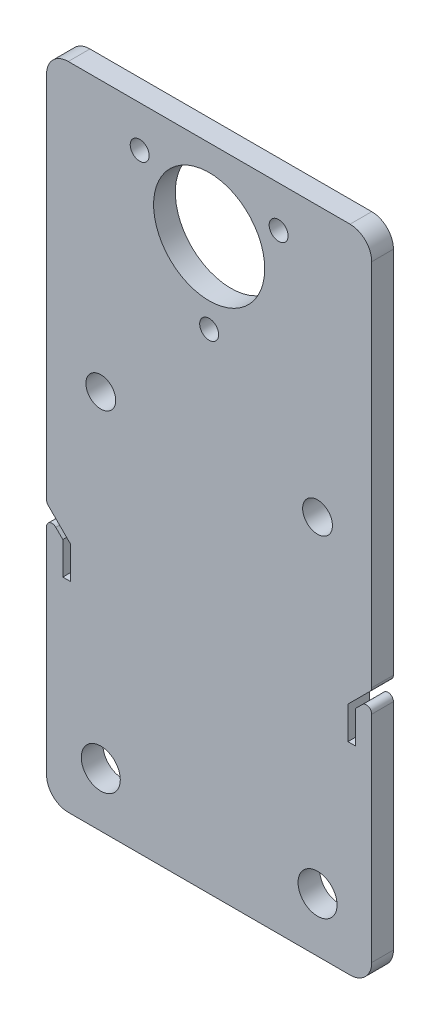
from build123d import *

# Parameters (mm, degrees)
SZKIC1_W                    = 60
SZKIC1_H                    = 120
SZKIC1_R                    = 2.75
SZKIC1_R_2                  = 3.6
SZKIC1_R_3                  = 10.25
SZKIC1_R_4                  = 1.75
DODANIE_WYCI_GNI_CIE1_DEPTH = 4
ZAOKR_GLENIE1_R             = 4
SZKIC2_W                    = 1.4
SZKIC2_H                    = 6
WYTNIJ_WYCI_GNI_CIE1_DEPTH  = 10
ZAOKR_GLENIE2_R             = 1
ZAOKR_GLENIE3_R             = 1


with BuildPart() as part:
    # Szkic1 → Dodanie-wyciągnięcie1 (new body)
    with BuildSketch(Plane.XY):
        with Locations((19.115931961, 35.506335127)):
            Rectangle(SZKIC1_W, SZKIC1_H)
        with Locations((-0.884068039, 45.706335127)):
            Circle(SZKIC1_R, mode=Mode.SUBTRACT)
        with Locations((-0.884068039, -14.493664873)):
            Circle(SZKIC1_R_2, mode=Mode.SUBTRACT)
        with Locations((39.115931961, -14.493664873)):
            Circle(SZKIC1_R_2, mode=Mode.SUBTRACT)
        with Locations((39.115931961, 45.706335127)):
            Circle(SZKIC1_R, mode=Mode.SUBTRACT)
        with Locations((19.115931961, 80.506335127)):
            Circle(SZKIC1_R_3, mode=Mode.SUBTRACT)
        with Locations((6.298755985, 87.906335127)):
            Circle(SZKIC1_R_4, mode=Mode.SUBTRACT)
        with Locations((31.933107937, 87.906335127)):
            Circle(SZKIC1_R_4, mode=Mode.SUBTRACT)
        with Locations((19.115931961, 65.706335127)):
            Circle(SZKIC1_R_4, mode=Mode.SUBTRACT)
    extrude(amount=DODANIE_WYCI_GNI_CIE1_DEPTH)

    # Zaokrąglenie1
    zaokr_glenie1_edges = [part.edges().sort_by_distance(p)[0] for p in [
        (-10.884068039, 95.506335127, 2),
        (49.115931961, 95.506335127, 2),
        (49.115931961, -24.493664873, 2),
        (-10.884068039, -24.493664873, 2),
    ]]
    fillet(zaokr_glenie1_edges, radius=ZAOKR_GLENIE1_R)

    # Szkic2 → Wytnij-wyciągnięcie1 (cut)
    with BuildSketch(Plane.XY.offset(4)):
        with Locations((-7.184068039, 15.606335127)):
            Rectangle(SZKIC2_W, SZKIC2_H)
        Polygon((-10.884068039, 21.606335127), (-7.884068039, 18.606335127), (-6.484068039, 18.606335127), (-10.884068039, 23.006335127), align=None)
        Polygon((49.115931961, 23.006335127), (44.715931961, 18.606335127), (46.115931961, 18.606335127), (49.115931961, 21.606335127), align=None)
        with Locations((45.415931961, 15.606335127)):
            Rectangle(SZKIC2_W, SZKIC2_H)
    extrude(amount=-WYTNIJ_WYCI_GNI_CIE1_DEPTH, mode=Mode.SUBTRACT)

    # Zaokrąglenie2
    zaokr_glenie2_edges = [part.edges().sort_by_distance(p)[0] for p in [
        (49.115931961, 21.606335127, 2),
        (49.115931961, 23.006335127, 2),
    ]]
    fillet(zaokr_glenie2_edges, radius=ZAOKR_GLENIE2_R)

    # Zaokrąglenie3
    zaokr_glenie3_edges = [part.edges().sort_by_distance(p)[0] for p in [
        (-10.884068039, 23.006335127, 2),
        (-10.884068039, 21.606335127, 2),
    ]]
    fillet(zaokr_glenie3_edges, radius=ZAOKR_GLENIE3_R)


solid = part.part
